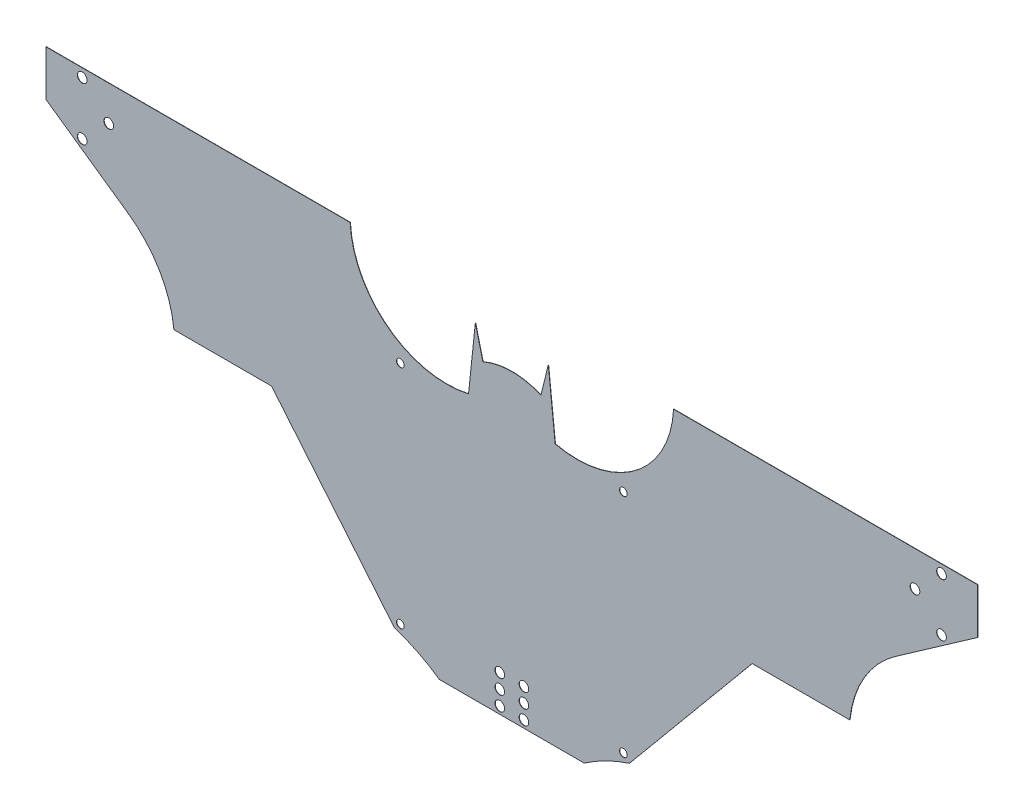
from build123d import *
from OCP.BRepFilletAPI import BRepFilletAPI_MakeChamfer

# Parameters (mm, degrees)
SKETCH2_R           = 1.5875
BOSS_EXTRUDE1_DEPTH = 0.118
SKETCH3_R           = 2
CUT_EXTRUDE1_DEPTH  = 267.27056526
CHAMFER1_SIZE       = 27
CHAMFER1_SIZE2      = 32.960913897
SKETCH4_W           = 60
SKETCH4_H           = 115.138092234
CUT_EXTRUDE2_DEPTH  = 245.436114198
SKETCH5_R           = 2
CUT_EXTRUDE3_DEPTH  = 214.991810964
LPATTERN1_COUNT     = 3
LPATTERN1_PITCH     = 6


with BuildPart() as part:
    # Sketch2 → Boss-Extrude1 (new body)
    with BuildSketch(Plane.XY):
        with BuildLine():
            Line((99.563224144, -21.926473835), (48.69, -83.15))
            ThreePointArc((48.69, -83.15), (13.462751156, -108.648946204), (0, -150))
            ThreePointArc((0, -150), (-13.462751156, -108.648946204), (-48.69, -83.15))
            Line((-48.69, -83.15), (-99.563224144, -21.926473835))
            Line((-99.563224144, -21.926473835), (-140, -21.926473835))
            ThreePointArc((-140, -21.926473835), (-145.965681261, -3.736597624), (-158.952536164, 10.327631798))
            Line((-158.952536164, 10.327631798), (-220, 53.073526165))
            Line((-220, 53.073526165), (-67, 53.073526165))
            ThreePointArc((-67, 53.073526165), (-51.137889855, 23.094319589), (-17.95554779, 16.073526165))
            Line((-17.95554779, 16.073526165), (-15.117733438, 43.073526165))
            Line((-15.117733438, 43.073526165), (-12, 30.568980335))
            ThreePointArc((-12, 30.568980335), (0, 33.073526165), (12, 30.568980335))
            Line((12, 30.568980335), (15.117733438, 43.073526165))
            Line((15.117733438, 43.073526165), (17.95554779, 16.073526165))
            ThreePointArc((17.95554779, 16.073526165), (51.137889855, 23.094319589), (67, 53.073526165))
            Line((67, 53.073526165), (220, 53.073526165))
            Line((220, 53.073526165), (158.952536164, 10.327631798))
            ThreePointArc((158.952536164, 10.327631798), (145.965681261, -3.736597624), (140, -21.926473835))
            Line((140, -21.926473835), (99.563224144, -21.926473835))
        make_face()
        with Locations((46.19, 13)):
            Circle(SKETCH2_R, mode=Mode.SUBTRACT)
        with Locations((-46.19, 13)):
            Circle(SKETCH2_R, mode=Mode.SUBTRACT)
        with Locations((46.19, -80.65)):
            Circle(SKETCH2_R, mode=Mode.SUBTRACT)
        with Locations((-46.19, -80.65)):
            Circle(SKETCH2_R, mode=Mode.SUBTRACT)
    extrude(amount=BOSS_EXTRUDE1_DEPTH)

    # Sketch3 → Cut-Extrude1 (cut, through all)
    with BuildSketch(Plane(origin=(0, 0, 0), x_dir=(-1, 0, 0), z_dir=(0, 0, -1))):
        with Locations((178, 49.573526165)):
            Circle(SKETCH3_R)
        with Locations((178, 27.573526165)):
            Circle(SKETCH3_R)
        with Locations((167, 38.573526165)):
            Circle(SKETCH3_R)
    cut_extrude1 = extrude(amount=-CUT_EXTRUDE1_DEPTH, mode=Mode.SUBTRACT)

    # Mirror2: Cut-Extrude1 across plane
    add(cut_extrude1.mirror(Plane(origin=(0, 0, 0), x_dir=(0, 0, 1), z_dir=(1, 0, 0))), mode=Mode.SUBTRACT)

    # Chamfer1: one chamfer whose edges measure the first distance from different faces: ONE call of the kernel's chamfer builder (chamfer() names one face for all edges)
    chamfer1_edges_1 = [part.edges().sort_by_distance(p)[0] for p in [
        (220, 53.073526165, 0.059),
    ]]
    chamfer1_side_1 = [part.faces().sort_by_distance(p)[0] for p in [
        (143.5, 53.073526165, 0.059),
    ]]
    chamfer1_edges_2 = [part.edges().sort_by_distance(p)[0] for p in [
        (-220, 53.073526165, 0.059),
    ]]
    chamfer1_side_2 = [part.faces().sort_by_distance(p)[0] for p in [
        (-143.5, 53.073526165, 0.059),
    ]]
    chamfer1 = BRepFilletAPI_MakeChamfer(part.part.solid().wrapped)
    for e in chamfer1_edges_1:
        chamfer1.Add(CHAMFER1_SIZE, CHAMFER1_SIZE2, e.wrapped, chamfer1_side_1[0].wrapped)  # the first distance lies on this face
    for e in chamfer1_edges_2:
        chamfer1.Add(CHAMFER1_SIZE, CHAMFER1_SIZE2, e.wrapped, chamfer1_side_2[0].wrapped)  # the first distance lies on this face
    add(Compound.cast(chamfer1.Shape()), mode=Mode.REPLACE)

    # Sketch4 → Cut-Extrude2 (cut, through all)
    with BuildSketch(Plane(origin=(0, 0, 0), x_dir=(-1, 0, 0), z_dir=(0, 0, -1))):
        with Locations((0, -150)):
            Rectangle(SKETCH4_W, SKETCH4_H)
    extrude(amount=-CUT_EXTRUDE2_DEPTH, mode=Mode.SUBTRACT)

    # Sketch5 → Cut-Extrude3 (cut, through all)
    with BuildSketch(Plane(origin=(0, 0, 0), x_dir=(-1, 0, 0), z_dir=(0, 0, -1))):
        with Locations((-5, -89.430953883)):
            Circle(SKETCH5_R)
        with Locations((5, -89.430953883)):
            Circle(SKETCH5_R)
    cut_extrude3 = extrude(amount=-CUT_EXTRUDE3_DEPTH, mode=Mode.SUBTRACT)

    # LPattern1: Cut-Extrude3 ×3
    with Locations(*[(0, i * LPATTERN1_PITCH, 0) for i in range(1, LPATTERN1_COUNT)]):
        add(cut_extrude3, mode=Mode.SUBTRACT)


solid = part.part
